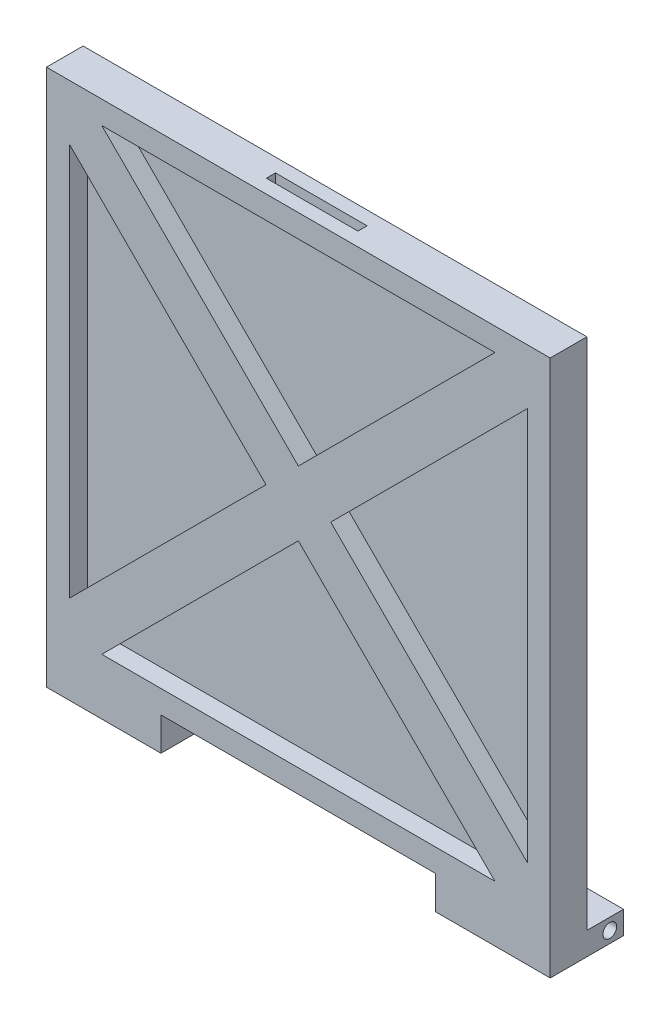
from build123d import *

# Parameters (mm, degrees)
SKETCH2_W               = 110
SKETCH2_H               = 110
BOSS_EXTRUDE1_DEPTH     = 8
BOSS_EXTRUDE2_DEPTH     = 25
CUT_EXTRUDE1_DEPTH      = 127.645420367
CUT_EXTRUDE1_DEPTH_BACK = 127.645420367
SKETCH10_R              = 1.5
CUT_EXTRUDE2_DEPTH      = 4
SKETCH12_W              = 20
SKETCH12_H              = 2
CUT_EXTRUDE3_DEPTH      = 2


with BuildPart() as part:
    # Sketch2 → Boss-Extrude1 (new body)
    with BuildSketch(Plane.XY):
        Rectangle(SKETCH2_W, SKETCH2_H)
    extrude(amount=BOSS_EXTRUDE1_DEPTH)

    # Sketch8 → Boss-Extrude2 (add)
    with BuildSketch(Plane(origin=(55, 0, 0), x_dir=(0, 0, -1), z_dir=(1, 0, 0))):
        Polygon((-8, -55), (-8, -62.25), (8, -62.25), (8, -57.25), (0, -57.25), (0, -55), align=None)
    boss_extrude2 = extrude(amount=-BOSS_EXTRUDE2_DEPTH)

    # Mirror1: Boss-Extrude2 across plane
    add(boss_extrude2.mirror(Plane(origin=(0, 0, 0), x_dir=(0, 0, 1), z_dir=(1, 0, 0))))

    # Sketch10 → Cut-Extrude1 (cut, two sides: drawn at the far end of the back side and taken through both)
    with BuildSketch(Plane.ZY.offset(55).offset(-CUT_EXTRUDE1_DEPTH_BACK)):
        with Locations((-5, -59.762907668)):
            Circle(SKETCH10_R)
    extrude(amount=CUT_EXTRUDE1_DEPTH + CUT_EXTRUDE1_DEPTH_BACK, mode=Mode.SUBTRACT)

    # Sketch11 → Cut-Extrude2 (cut)
    with BuildSketch(Plane.XY.offset(8)):
        Polygon((-42.928932188, 50), (0, 7.071067812), (42.928932188, 50), align=None)
        Polygon((50, -42.928932188), (50, 42.928932188), (7.071067812, 0), align=None)
        Polygon((-42.928932188, -50), (42.928932188, -50), (0, -7.071067812), align=None)
        Polygon((-50, 42.928932188), (-50, -42.928932188), (-7.071067812, 0), align=None)
    extrude(amount=-CUT_EXTRUDE2_DEPTH, mode=Mode.SUBTRACT)

    # Sketch12 → Cut-Extrude3 (cut)
    with BuildSketch(Plane(origin=(0, 55, 0), x_dir=(1, 0, 0), z_dir=(0, 1, 0))):
        with Locations((0, -4)):
            Rectangle(SKETCH12_W, SKETCH12_H)
    extrude(amount=-CUT_EXTRUDE3_DEPTH, mode=Mode.SUBTRACT)


solid = part.part
